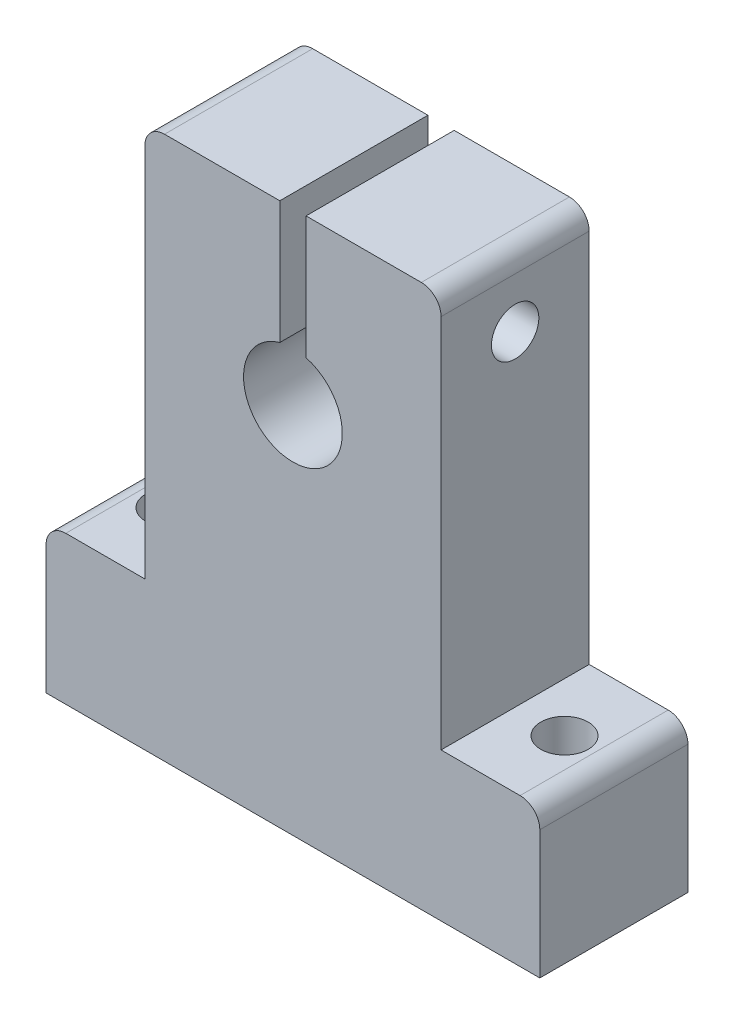
from build123d import *

# Parameters (mm, degrees)
SKETCH1_W                       = 50
SKETCH1_H                       = 15
SKETCH1_R                       = 2.4
BOSS_EXTRUDE1_DEPTH             = 15
BOSS_EXTRUDE2_REACH             = 32.104
BOSS_EXTRUDE2_DIRECTION_2_REACH = 32.104
FILLET1_R                       = 2
SKETCH4_R                       = 2.4
CUT_EXTRUDE1_DEPTH              = 69.419660917


with BuildPart() as part:
    # Sketch1 → Boss-Extrude1 (new body)
    with BuildSketch(Plane(origin=(0, 0, 0), x_dir=(1, 0, 0), z_dir=(0, 1, 0))):
        Rectangle(SKETCH1_W, SKETCH1_H)
        with Locations((-20, 0)):
            Circle(SKETCH1_R, mode=Mode.SUBTRACT)
        with Locations((20, 0)):
            Circle(SKETCH1_R, mode=Mode.SUBTRACT)
    extrude(amount=BOSS_EXTRUDE1_DEPTH)

    # Boss-Extrude2: up to this face of the body (flat: up to its plane)
    boss_extrude2_end = Plane(part.part.faces().sort_by_distance((0, 7.5, 7.5))[0])
    # Sketch3 → Boss-Extrude2 (add, up to the picked face)
    with BuildSketch(Plane.XY, mode=Mode.PRIVATE) as boss_extrude2_sk1:
        with BuildLine():
            Line((1.328723236, 55), (1.328723236, 42.566882454))
            ThreePointArc((1.328723236, 42.566882454), (0, 32.746665181), (-1.328723236, 42.566882454))
            Line((-1.328723236, 42.566882454), (-1.328723236, 55))
            Line((-1.328723236, 55), (-3.865793159, 55))
            Line((-3.865793159, 55), (-13, 55))
            ThreePointArc((-13, 55), (-14.414213562, 54.414213562), (-15, 53))
            Line((-15, 53), (-15, 15))
            Line((-15, 15), (15, 15))
            Line((15, 15), (15, 53))
            ThreePointArc((15, 53), (14.414213562, 54.414213562), (13, 55))
            Line((13, 55), (3.865793159, 55))
            Line((3.865793159, 55), (1.328723236, 55))
        make_face()
    boss_extrude2_tool1 = split(extrude(boss_extrude2_sk1.sketch, amount=BOSS_EXTRUDE2_REACH, mode=Mode.PRIVATE), bisect_by=boss_extrude2_end, keep=Keep.BOTH, mode=Mode.PRIVATE)
    add(boss_extrude2_tool1.solids().sort_by(Axis((14.06066, 54.06066, 0), (0, 0, 1)))[0])

    # Boss-Extrude2 direction 2: up to this face of the body (flat: up to its plane)
    boss_extrude2_direction_2_end = Plane(part.part.faces().sort_by_distance((0, 7.5, -7.5))[0])
    # Sketch3 → Boss-Extrude2 direction 2 (add, up to the picked face)
    with BuildSketch(Plane.XY, mode=Mode.PRIVATE) as boss_extrude2_direction_2_sk1:
        with BuildLine():
            Line((1.328723236, 55), (1.328723236, 42.566882454))
            ThreePointArc((1.328723236, 42.566882454), (0, 32.746665181), (-1.328723236, 42.566882454))
            Line((-1.328723236, 42.566882454), (-1.328723236, 55))
            Line((-1.328723236, 55), (-3.865793159, 55))
            Line((-3.865793159, 55), (-13, 55))
            ThreePointArc((-13, 55), (-14.414213562, 54.414213562), (-15, 53))
            Line((-15, 53), (-15, 15))
            Line((-15, 15), (15, 15))
            Line((15, 15), (15, 53))
            ThreePointArc((15, 53), (14.414213562, 54.414213562), (13, 55))
            Line((13, 55), (3.865793159, 55))
            Line((3.865793159, 55), (1.328723236, 55))
        make_face()
    boss_extrude2_direction_2_tool1 = split(extrude(boss_extrude2_direction_2_sk1.sketch, amount=-BOSS_EXTRUDE2_DIRECTION_2_REACH, mode=Mode.PRIVATE), bisect_by=boss_extrude2_direction_2_end, keep=Keep.BOTH, mode=Mode.PRIVATE)
    add(boss_extrude2_direction_2_tool1.solids().sort_by(Axis((14.06066, 54.06066, 0), (0, 0, -1)))[0])

    # Fillet1
    fillet1_edges = [part.edges().sort_by_distance(p)[0] for p in [
        (-25, 15, 0),
        (25, 15, 0),
    ]]
    fillet(fillet1_edges, radius=FILLET1_R)

    # Sketch4 → Cut-Extrude1 (cut, through all)
    with BuildSketch(Plane.ZY.offset(15)):
        with Locations((0, 47.934840873)):
            Circle(SKETCH4_R)
    extrude(amount=-CUT_EXTRUDE1_DEPTH, mode=Mode.SUBTRACT)


solid = part.part
